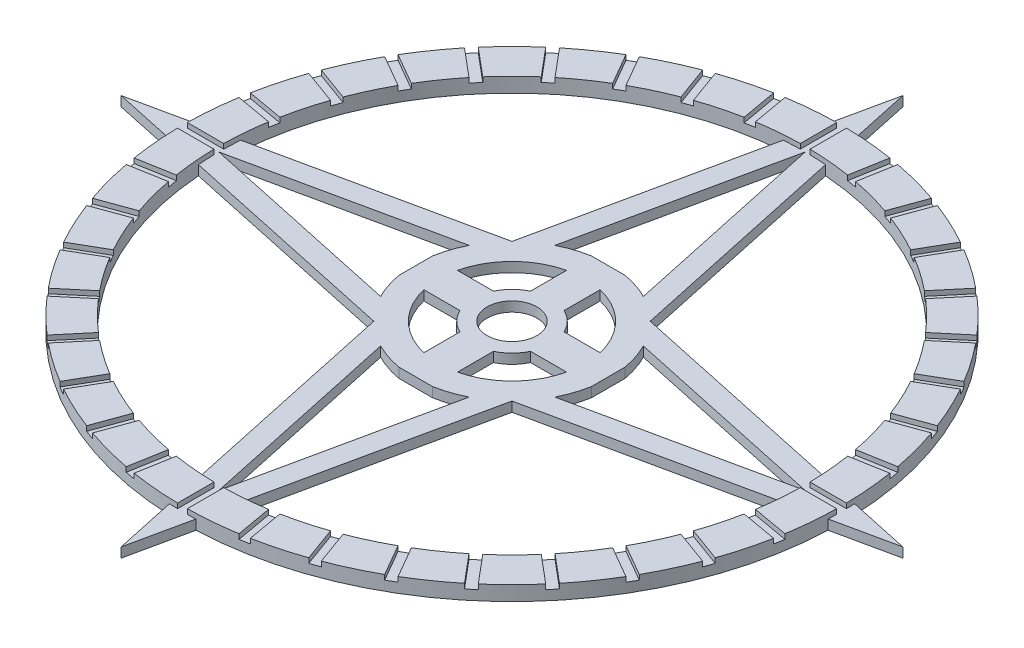
from build123d import *

# Parameters (mm, degrees)
SKETCH1_R           = 5.100000000000002
BOSS_EXTRUDE1_DEPTH = 2
BOSS_EXTRUDE3_START = -2
SKETCH3_R           = 67.45411173885752
SKETCH3_R_2         = 60
BOSS_EXTRUDE3_DEPTH = 3
CUT_EXTRUDE2_START  = -1
CUT_EXTRUDE2_DEPTH  = 1


with BuildPart() as part:
    # Sketch1 → Boss-Extrude1 (new body)
    with BuildSketch(Plane(origin=(0, 0, 0), x_dir=(1, 0, 0), z_dir=(0, 1, 0))):
        Polygon((-14.142135623731019, -14.14213562373088), (-5.5517e-13, -80), (14.142135623730827, -14.142135623731079), (80, -2.7811e-13), (14.142135623731022, 14.142135623730876), (0, 80), (-14.142135623730923, 14.14213562373098), (-80, 8.3796e-13), align=None)
        with BuildLine():
            ThreePointArc((3.435661309281439, -19.702696043128377), (6.31485660112035, -18.97689611362424), (9.054863753710231, -17.83281924996002))
            Line((9.054863753710144, -17.83281924995995), (-4.1567e-13, -60))
            Line((-4.1551e-13, -60), (-9.054863753710384, -17.83281924995984))
            ThreePointArc((-9.054863753710475, -17.832819249959897), (-6.314856601120475, -18.976896113624196), (-3.4356613092814463, -19.702696043128373))
            Line((-3.435661309281439, -19.702696043128373), (3.435661309281439, -19.702696043128373))
        make_face(mode=Mode.SUBTRACT)
        with BuildLine():
            ThreePointArc((-7.224695936017446, -3.4356613092813726), (-5.656854249492367, -5.656854249492393), (-3.4356613092813397, -7.224695936017461))
            Line((-3.435661309281439, -7.224695936017493), (-3.435661309281439, -14.601240747549916))
            ThreePointArc((-3.435661309281024, -14.601240747549827), (-10.606601717798231, -10.606601717798197), (-14.60124074754984, -3.435661309280978))
            Line((-14.601240747549925, -3.4356613092814103), (-7.224695936017458, -3.4356613092814734))
        make_face(mode=Mode.SUBTRACT)
        with BuildLine():
            Line((3.435661309281439, -14.601240747549916), (3.435661309281439, -7.224695936017337))
            ThreePointArc((3.435661309281536, -7.224695936017369), (5.656854249492502, -5.65685424949226), (7.224695936017516, -3.435661309281227))
            Line((7.224695936017593, -3.435661309281478), (14.601240747549618, -3.435661309281494))
            ThreePointArc((14.601240747549667, -3.435661309281709), (10.606601717797965, -10.606601717798464), (3.4356613092810186, -14.601240747549829))
        make_face(mode=Mode.SUBTRACT)
        with Locations(Location((0, 1.78e-15, 0), (0, 0, 270))):
            Circle(SKETCH1_R, mode=Mode.SUBTRACT)
        with BuildLine():
            Line((19.702696043128363, -3.4356613092815045), (19.702696043128384, 3.435661309281374))
            ThreePointArc((19.702696043128388, 3.4356613092813744), (18.97689611362424, 6.314856601120345), (17.832819249959986, 9.054863753710297))
            Line((17.832819249959915, 9.054863753710205), (60, -2.0783e-13))
            Line((60, -2.0828e-13), (17.832819249959876, -9.054863753710324))
            ThreePointArc((17.83281924995993, -9.054863753710412), (18.976896113624196, -6.314856601120477), (19.702696043128363, -3.4356613092815182))
        make_face(mode=Mode.SUBTRACT)
        with BuildLine():
            Line((-17.83281924995999, -9.054863753710078), (-60, 6.2883e-13))
            Line((-60, 6.2847e-13), (-17.832819249959798, 9.054863753710402))
            ThreePointArc((-17.83281924995986, 9.054863753710546), (-18.976896113624175, 6.3148566011205425), (-19.702696043128363, 3.435661309281515))
            Line((-19.702696043128363, 3.435661309281512), (-19.702696043128384, -3.4356613092813664))
            ThreePointArc((-19.70269604312839, -3.435661309281362), (-18.976896113624267, -6.314856601120268), (-17.832819249960053, -9.054863753710169))
        make_face(mode=Mode.SUBTRACT)
        with BuildLine():
            Line((-7.224695936017445, 3.435661309281468), (-14.601240747549904, 3.435661309281494))
            ThreePointArc((-14.601240747549815, 3.435661309281081), (-10.606601717798197, 10.606601717798235), (-3.435661309281025, 14.601240747549829))
            Line((-3.435661309281439, 14.601240747549912), (-3.435661309281439, 7.224695936017497))
            ThreePointArc((-3.435661309281337, 7.224695936017463), (-5.656854249492351, 5.65685424949241), (-7.224695936017428, 3.435661309281412))
        make_face(mode=Mode.SUBTRACT)
        with BuildLine():
            Line((14.601240747549639, 3.4356613092813912), (7.224695936017596, 3.435661309281417))
            ThreePointArc((7.224695936017528, 3.435661309281202), (5.65685424949251, 5.65685424949225), (3.435661309281535, 7.22469593601737))
            Line((3.435661309281439, 7.224695936017337), (3.435661309281439, 14.601240747549912))
            ThreePointArc((3.4356613092810275, 14.601240747549827), (10.606601717798, 10.606601717798428), (14.601240747549687, 3.435661309281623))
        make_face(mode=Mode.SUBTRACT)
        with BuildLine():
            Line((-9.054863753710237, 17.832819249959883), (0, 60))
            Line((0, 60), (9.054863753710263, 17.832819249959897))
            ThreePointArc((9.054863753710354, 17.83281924995996), (6.314856601120406, 18.97689611362422), (3.4356613092814396, 19.702696043128377))
            Line((3.435661309281439, 19.702696043128373), (-3.435661309281439, 19.702696043128373))
            ThreePointArc((-3.4356613092814374, 19.702696043128377), (-6.314856601120412, 18.976896113624218), (-9.05486375371036, 17.832819249959954))
        make_face(mode=Mode.SUBTRACT)
    extrude(amount=BOSS_EXTRUDE1_DEPTH)

    # Sketch3 → Boss-Extrude3 (add)
    with BuildSketch(Plane(origin=(0, 2, 0), x_dir=(1, 0, 0), z_dir=(0, 1, 0)).offset(BOSS_EXTRUDE3_START)):
        with Locations(Location((0, 0, 0), (0, 0, 87.701128414))):
            Circle(SKETCH3_R)
        with Locations(Location((0, 0, 0), (0, 0, 270))):
            Circle(SKETCH3_R_2, mode=Mode.SUBTRACT)
    extrude(amount=BOSS_EXTRUDE3_DEPTH)

    # Sketch4 → Cut-Extrude2 (cut)
    with BuildSketch(Plane(origin=(0, 3, 0), x_dir=(1, 0, 0), z_dir=(0, 1, 0)).offset(CUT_EXTRUDE2_START)):
        with BuildLine():
            ThreePointArc((-0.9999999999980442, 59.99166608788261), (-0.5000173632203273, 59.997916485795386), (3.67e-15, 60))
            ThreePointArc((3.67e-15, 60), (0.5000173632203346, 59.997916485795386), (0.9999999999980382, 59.99166608788261))
            Line((0.9999999999999998, 59.991666087882635), (0.9999999999999998, 67.44669888495864))
            ThreePointArc((0.999999999999044, 67.44669888495862), (-8.9454e-13, 67.45411173885752), (-1.000000000000848, 67.4466988849586))
            Line((-1.0000000000000002, 67.44669888495858), (-1.0000000000000002, 59.991666087882635))
        make_face()
        with BuildLine():
            ThreePointArc((9.4326357383524, 59.25390605713312), (9.926107885630383, 59.1732404237154), (10.418890660015839, 59.088465180732484))
            ThreePointArc((10.418890660015839, 59.088465180732484), (10.910949837511692, 58.99958621586514), (11.40225124437515, 58.90660970179955))
            Line((11.402251244376025, 58.90660970179941), (12.69680410403548, 66.24838379932018))
            ThreePointArc((12.69680410403481, 66.24838379932028), (11.713283579592677, 66.42933221297893), (10.72718859800881, 66.59568015465437))
            Line((10.727188598011047, 66.59568015465393), (9.43263573835161, 59.25390605713328))
        make_face()
        with BuildLine():
            ThreePointArc((19.578665612936884, 56.715746074761306), (20.050633369229132, 56.550615394465474), (20.521208599540167, 56.38155724715448))
            ThreePointArc((20.521208599540167, 56.38155724715448), (20.99035862219668, 56.208583373997016), (21.45805085450822, 56.03170578811017))
            Line((21.458050854509214, 56.031705788109825), (24.007822240262705, 63.03714509523905))
            ThreePointArc((24.007822240263334, 63.037145095238834), (23.070664964830335, 63.38613104267231), (22.128436998691413, 63.72118538189022))
            Line((22.128436998690905, 63.72118538189042), (19.578665612937378, 56.715746074761114))
        make_face()
        with BuildLine():
            ThreePointArc((29.129807640156454, 52.45430684745994), (29.565930504014553, 52.20972853244673), (30.000000000000068, 51.961524227066285))
            ThreePointArc((30.000000000000068, 51.961524227066285), (30.431985981780567, 51.70971116922537), (30.861858447725478, 51.45430684745987))
            Line((30.861858447725794, 51.45430684745969), (34.589374846263794, 57.910554635773664))
            ThreePointArc((34.589374846264285, 57.910554635773394), (33.727055869429066, 58.41697435556455), (32.85732403869491, 58.91055463577369))
            Line((32.857324038694934, 58.91055463577367), (29.129807640156905, 52.45430684745967))
        make_face()
        with BuildLine():
            ThreePointArc((37.79585520262428, 46.599070049758055), (38.18288180151847, 46.28247548836676), (38.56725658119243, 45.96266658713863))
            ThreePointArc((38.56725658119243, 45.96266658713863), (38.94895284663565, 45.63966555695334), (39.32794408886184, 45.31349483038532))
            Line((39.32794408886212, 45.313494830385096), (44.11994680062932, 51.02438127785484))
            ThreePointArc((44.11994680063125, 51.02438127785328), (43.35866724815002, 51.672847463077545), (42.587857914391485, 52.30995649722794))
            Line((42.58785791439141, 52.30995649722799), (37.79585520262415, 46.599070049758176))
        make_face()
        with BuildLine():
            ThreePointArc((45.313494830385466, 39.32794408886167), (45.639665556953474, 38.948952846635486), (45.962666587138756, 38.567256581192275))
            ThreePointArc((45.962666587138756, 38.567256581192275), (46.282475488366885, 38.18288180151831), (46.59907004975818, 37.79585520262413))
            Line((46.5990700497583, 37.795855202624), (52.30995649722813, 42.58785791439124))
            ThreePointArc((52.30995649722806, 42.58785791439132), (51.67284746307768, 43.35866724814985), (51.024381277853436, 44.11994680063108))
            Line((51.024381277855, 44.11994680062915), (45.31349483038523, 39.327944088861955))
        make_face()
        with BuildLine():
            ThreePointArc((51.45430684745998, 30.86185844772529), (51.709711169225486, 30.43198598178038), (51.96152422706639, 29.999999999999876))
            ThreePointArc((51.96152422706639, 29.999999999999876), (52.20972853244683, 29.56593050401436), (52.454306847460046, 29.12980764015626))
            Line((52.45430684745978, 29.12980764015672), (58.9105546357738, 32.85732403869472))
            ThreePointArc((58.91055463577382, 32.857324038694685), (58.41697435556468, 33.72705586942884), (57.91055463577353, 34.589374846264064))
            Line((57.91055463577379, 34.589374846263595), (51.454306847459804, 30.861858447725613))
        make_face()
        with BuildLine():
            ThreePointArc((56.03170578811024, 21.45805085450804), (56.20858337399708, 20.9903586221965), (56.38155724715456, 20.521208599539975))
            ThreePointArc((56.38155724715456, 20.521208599539975), (56.55061539446554, 20.050633369228947), (56.71574607476137, 19.5786656129367))
            Line((56.715746074761185, 19.5786656129372), (63.72118538189049, 22.128436998690695))
            ThreePointArc((63.7211853818903, 22.128436998691214), (63.38613104267238, 23.07066496483013), (63.03714509523891, 24.007822240263124))
            Line((63.037145095239126, 24.007822240262502), (56.0317057881099, 21.458050854509036))
        make_face()
        with BuildLine():
            ThreePointArc((58.906609701799596, 11.402251244374947), (58.99958621586517, 10.910949837511499), (59.08846518073251, 10.418890660015643))
            ThreePointArc((59.08846518073251, 10.418890660015643), (59.173240423715434, 9.926107885630188), (59.25390605713315, 9.432635738352193))
            Line((59.25390605713331, 9.43263573835141), (66.59568015465398, 10.727188598010823))
            ThreePointArc((66.5956801546544, 10.727188598008567), (66.42933221297898, 11.713283579592437), (66.24838379932031, 12.696804104034586))
            Line((66.24838379932021, 12.696804104035254), (58.90660970179945, 11.402251244375828))
        make_face()
        with BuildLine():
            ThreePointArc((59.991666087882614, 0.9999999999978303), (59.997916485795386, 0.5000173632202288), (60, 0))
            ThreePointArc((60, -1.47e-14), (59.997916485795386, -0.5000173632204522), (59.99166608788261, -0.9999999999982624))
            Line((59.991666087882635, -1.0000000000002163), (67.44669888495862, -1.0000000000002423))
            ThreePointArc((67.44669888495861, -0.9999999999994907), (67.45225849992478, -0.5000137374117688), (67.45411173885752, -1.652e-14))
            ThreePointArc((67.45411173885752, 0), (67.45225849992478, 0.5000137374115408), (67.44669888495862, 0.9999999999990511))
            Line((67.44669888495862, 0.9999999999997579), (59.99166608788264, 0.9999999999997838))
        make_face()
        with BuildLine():
            ThreePointArc((59.253906057133094, -9.432635738352582), (59.17324042371537, -9.926107885630579), (59.08846518073245, -10.418890660016032))
            ThreePointArc((59.08846518073245, -10.418890660016032), (58.9995862158651, -10.910949837511886), (58.906609701799525, -11.402251244375329))
            Line((58.906609701799376, -11.402251244376222), (66.24838379932012, -12.6968041040357))
            ThreePointArc((66.24838379932022, -12.696804104035056), (66.42933221297889, -11.713283579592867), (66.59568015465433, -10.727188598009015))
            Line((66.5956801546539, -10.72718859801127), (59.25390605713324, -9.432635738351811))
        make_face()
        with BuildLine():
            ThreePointArc((56.71574607476124, -19.578665612937083), (56.550615394465396, -20.050633369229356), (56.38155724715441, -20.521208599540365))
            ThreePointArc((56.38155724715441, -20.521208599540365), (56.20858337399693, -20.990358622196904), (56.0317057881101, -21.458050854508414))
            Line((56.031705788109754, -21.458050854509413), (63.03714509523896, -24.00782224026293))
            ThreePointArc((63.03714509523877, -24.00782224026351), (63.38613104267225, -23.0706649648305), (63.72118538189016, -22.128436998691623))
            Line((63.721185381890336, -22.128436998691125), (56.71574607476105, -19.57866561293758))
        make_face()
        with BuildLine():
            ThreePointArc((52.45430684745984, -29.12980764015664), (52.209728532446626, -29.565930504014723), (51.96152422706617, -30.00000000000026))
            ThreePointArc((51.96152422706617, -30.00000000000026), (51.70971116922529, -30.431985981780713), (51.45430684745981, -30.861858447725577))
            Line((51.45430684745959, -30.861858447725968), (57.91055463577354, -34.589374846264))
            ThreePointArc((57.910554635773266, -34.5893748462645), (58.41697435556444, -33.72705586942926), (58.91055463577359, -32.85732403869509))
            Line((58.910554635773565, -32.85732403869513), (52.45430684745958, -29.12980764015708))
        make_face()
        with BuildLine():
            ThreePointArc((46.59907004975792, -37.795855202624466), (46.28247548836661, -38.182881801518654), (45.9626665871385, -38.567256581192574))
            ThreePointArc((45.9626665871385, -38.567256581192574), (45.63966555695321, -38.94895284663579), (45.313494830385196, -39.327944088861976))
            Line((45.313494830384975, -39.32794408886225), (51.02438127785471, -44.11994680062948))
            ThreePointArc((51.0243812778531, -44.119946800631446), (51.67284746307738, -43.35866724815021), (52.30995649722778, -42.58785791439167))
            Line((52.30995649722785, -42.587857914391584), (46.599070049758055, -37.7958552026243))
        make_face()
        with BuildLine():
            ThreePointArc((39.327944088861514, -45.3134948303856), (38.94895284663533, -45.63966555695361), (38.56725658119211, -45.96266658713889))
            ThreePointArc((38.56725658119211, -45.96266658713889), (38.18288180151814, -46.28247548836703), (37.795855202623954, -46.59907004975833))
            Line((37.79585520262385, -46.599070049758424), (42.58785791439108, -52.30995649722827))
            ThreePointArc((42.58785791439114, -52.309956497228214), (43.358667248149644, -51.67284746307786), (44.119946800630885, -51.0243812778536))
            Line((44.11994680062899, -51.02438127785514), (39.32794408886181, -45.31349483038535))
        make_face()
        with BuildLine():
            ThreePointArc((30.86185844772505, -51.454306847460124), (30.43198598178014, -51.70971116922562), (29.99999999999968, -51.961524227066505))
            ThreePointArc((29.99999999999968, -51.961524227066505), (29.56593050401419, -52.20972853244693), (29.129807640156102, -52.45430684746013))
            Line((29.12980764015654, -52.45430684745987), (32.85732403869453, -58.91055463577392))
            ThreePointArc((32.85732403869449, -58.910554635773934), (33.72705586942861, -58.41697435556481), (34.589374846263865, -57.91055463577365))
            Line((34.589374846263404, -57.910554635773906), (30.86185844772544, -51.45430684745991))
        make_face()
        with BuildLine():
            ThreePointArc((21.458050854507796, -56.03170578811033), (20.990358622196283, -56.20858337399716), (20.52120859953979, -56.381557247154625))
            ThreePointArc((20.52120859953979, -56.381557247154625), (20.05063336922873, -56.550615394465616), (19.578665612936454, -56.71574607476146))
            Line((19.578665612937, -56.71574607476125), (22.128436998690468, -63.72118538189057))
            ThreePointArc((22.128436998690972, -63.72118538189038), (23.070664964829852, -63.38613104267248), (24.007822240262815, -63.037145095239026))
            Line((24.007822240262282, -63.03714509523922), (21.45805085450884, -56.031705788109974))
        make_face()
        with BuildLine():
            ThreePointArc((11.402251244374728, -58.90660970179964), (10.910949837511284, -58.999586215865214), (10.41889066001543, -59.088465180732555))
            ThreePointArc((10.41889066001543, -59.088465180732555), (9.926107885629975, -59.17324042371547), (9.43263573835203, -59.25390605713318))
            Line((9.43263573835122, -59.25390605713334), (10.72718859801061, -66.59568015465402))
            ThreePointArc((10.727188598008336, -66.59568015465445), (11.713283579592249, -66.429332212979), (12.69680410403438, -66.24838379932035))
            Line((12.69680410403504, -66.24838379932025), (11.402251244375638, -58.906609701799496))
        make_face()
        with BuildLine():
            ThreePointArc((0.9999999999975441, -59.991666087882614), (0.5000173632198937, -59.99791648579539), (-4.3735e-13, -60))
            ThreePointArc((-4.3735e-13, -60), (-0.5000173632207684, -59.997916485795386), (-0.9999999999984186, -59.9916660878826))
            Line((-1.0000000000004188, -59.991666087882635), (-1.0000000000004707, -67.44669888495858))
            ThreePointArc((-1.0000000000013436, -67.44669888495858), (-1.33044e-12, -67.45411173885752), (0.9999999999986232, -67.44669888495862))
            Line((0.9999999999995293, -67.44669888495864), (0.9999999999995813, -59.99166608788264))
        make_face()
        with BuildLine():
            ThreePointArc((-9.432635738352788, -59.25390605713306), (-9.926107885630785, -59.173240423715335), (-10.41889066001624, -59.088465180732406))
            ThreePointArc((-10.41889066001624, -59.088465180732406), (-10.910949837512092, -58.99958621586506), (-11.402251244375536, -58.90660970179948))
            Line((-11.402251244376433, -58.90660970179934), (-12.696804104035934, -66.24838379932008))
            ThreePointArc((-12.696804104035287, -66.24838379932018), (-11.713283579593098, -66.42933221297886), (-10.727188598009247, -66.5956801546543))
            Line((-10.727188598011505, -66.59568015465388), (-9.432635738352017, -59.2539060571332))
        make_face()
        with BuildLine():
            ThreePointArc((-19.57866561293728, -56.71574607476117), (-20.050633369229555, -56.55061539446532), (-20.52120859954056, -56.38155724715435))
            ThreePointArc((-20.52120859954056, -56.38155724715435), (-20.990358622197103, -56.20858337399685), (-21.458050854508613, -56.03170578811002))
            Line((-21.45805085450959, -56.03170578810968), (-24.007822240263124, -63.037145095238884))
            ThreePointArc((-24.00782224026373, -63.03714509523868), (-23.070664964830723, -63.38613104267217), (-22.128436998691846, -63.72118538189007))
            Line((-22.128436998691335, -63.72118538189028), (-19.578665612937765, -56.71574607476099))
        make_face()
        with BuildLine():
            ThreePointArc((-29.129807640156823, -52.45430684745973), (-29.565930504014904, -52.209728532446526), (-30.00000000000044, -51.961524227066064))
            ThreePointArc((-30.00000000000044, -51.961524227066064), (-30.431985981780894, -51.70971116922517), (-30.861858447725755, -51.454306847459705))
            Line((-30.861858447726156, -51.454306847459485), (-34.58937484626421, -57.91055463577342))
            ThreePointArc((-34.589374846264704, -57.910554635773146), (-33.72705586942951, -58.41697435556429), (-32.8573240386954, -58.91055463577342))
            Line((-32.857324038695346, -58.91055463577345), (-29.129807640157264, -52.45430684745946))
        make_face()
        with BuildLine():
            ThreePointArc((-37.79585520262459, -46.59907004975782), (-38.182881801518775, -46.28247548836651), (-38.567256581192744, -45.96266658713836))
            ThreePointArc((-38.567256581192744, -45.96266658713836), (-38.948952846635954, -45.63966555695308), (-39.32794408886214, -45.31349483038506))
            Line((-39.32794408886241, -45.31349483038484), (-44.11994680062966, -51.024381277854566))
            ThreePointArc((-44.1199468006316, -51.02438127785297), (-43.35866724815039, -51.67284746307722), (-42.587857914391904, -52.30995649722759))
            Line((-42.58785791439177, -52.3099564972277), (-37.795855202624466, -46.59907004975793))
        make_face()
        with BuildLine():
            ThreePointArc((-45.313494830385736, -39.32794408886136), (-45.639665556953744, -38.948952846635166), (-45.962666587139005, -38.56725658119197))
            ThreePointArc((-45.962666587139005, -38.56725658119197), (-46.282475488367126, -38.18288180151802), (-46.59907004975843, -37.79585520262383))
            Line((-46.59907004975855, -37.795855202623684), (-52.30995649722842, -42.58785791439089))
            ThreePointArc((-52.30995649722836, -42.58785791439096), (-51.67284746307797, -43.35866724814951), (-51.024381277853735, -44.11994680063073))
            Line((-51.02438127785529, -44.11994680062881), (-45.313494830385494, -39.32794408886166))
        make_face()
        with BuildLine():
            ThreePointArc((-51.45430684746019, -30.861858447724938), (-51.709711169225706, -30.431985981780002), (-51.96152422706661, -29.9999999999995))
            ThreePointArc((-51.96152422706661, -29.9999999999995), (-52.209728532447045, -29.565930504013984), (-52.45430684746026, -29.12980764015587))
            Line((-52.454306847459975, -29.129807640156347), (-58.91055463577403, -32.857324038694316))
            ThreePointArc((-58.91055463577404, -32.85732403869429), (-58.41697435556492, -33.72705586942843), (-57.91055463577377, -34.58937484626366))
            Line((-57.91055463577402, -34.5893748462632), (-51.45430684746002, -30.861858447725254))
        make_face()
        with BuildLine():
            ThreePointArc((-56.03170578811039, -21.45805085450765), (-56.208583373997214, -20.990358622196137), (-56.38155724715469, -20.52120859953962))
            ThreePointArc((-56.38155724715469, -20.52120859953962), (-56.550615394465666, -20.05063336922858), (-56.715746074761505, -19.578665612936305))
            Line((-56.71574607476131, -19.578665612936835), (-63.721185381890635, -22.128436998690287))
            ThreePointArc((-63.72118538189046, -22.128436998690752), (-63.38613104267254, -23.07066496482969), (-63.037145095239076, -24.00782224026271))
            Line((-63.03714509523928, -24.007822240262094), (-56.03170578811003, -21.458050854508674))
        make_face()
        with BuildLine():
            ThreePointArc((-58.90660970179967, -11.40225124437455), (-58.99958621586525, -10.910949837511104), (-59.088465180732584, -10.41889066001525))
            ThreePointArc((-59.088465180732584, -10.41889066001525), (-59.1732404237155, -9.926107885629769), (-59.25390605713322, -9.43263573835177))
            Line((-59.253906057133364, -9.43263573835102), (-66.59568015465405, -10.727188598010382))
            ThreePointArc((-66.59568015465449, -10.727188598008134), (-66.42933221297905, -11.713283579592016), (-66.24838379932041, -12.69680410403415))
            Line((-66.2483837993203, -12.696804104034817), (-58.90660970179953, -11.402251244375442))
        make_face()
        with BuildLine():
            ThreePointArc((-59.99166608788262, -0.9999999999974412), (-59.99791648579539, -0.5000173632200305), (-60, 7.35e-15))
            ThreePointArc((-60, 7.35e-15), (-59.997916485795386, 0.500017363220658), (-59.9916660878826, 0.9999999999986815))
            Line((-59.99166608788263, 1.0000000000006213), (-67.4466988849586, 1.0000000000006994))
            ThreePointArc((-67.4466988849586, 1.0000000000008602), (-67.45411173885752, 6.6728e-13), (-67.44669888495861, -0.999999999999496))
            Line((-67.44669888495861, -0.9999999999993007), (-59.99166608788265, -0.9999999999993787))
        make_face()
        with BuildLine():
            ThreePointArc((-59.25390605713302, 9.432635738352996), (-59.1732404237153, 9.92610788563099), (-59.08846518073238, 10.418890660016446))
            ThreePointArc((-59.08846518073238, 10.418890660016446), (-58.99958621586503, 10.910949837512298), (-58.90660970179944, 11.40225124437574))
            Line((-58.9066097017993, 11.402251244376624), (-66.24838379932004, 12.696804104036147))
            ThreePointArc((-66.24838379932014, 12.69680410403549), (-66.42933221297882, 11.71328357959333), (-66.59568015465426, 10.72718859800948))
            Line((-66.59568015465383, 10.727188598011722), (-59.25390605713317, 9.432635738352209))
        make_face()
        with BuildLine():
            ThreePointArc((-56.71574607476111, 19.578665612937478), (-56.55061539446526, 20.050633369229725), (-56.38155724715427, 20.52120859954076))
            ThreePointArc((-56.38155724715427, 20.52120859954076), (-56.2085833739968, 20.99035862219725), (-56.03170578810996, 21.458050854508784))
            Line((-56.031705788109605, 21.458050854509786), (-63.037145095238806, 24.00782224026335))
            ThreePointArc((-63.037145095238586, 24.00782224026398), (-63.386131042672076, 23.07066496483097), (-63.72118538189001, 22.128436998692038))
            Line((-63.721185381890194, 22.128436998691555), (-56.715746074760915, 19.578665612937964))
        make_face()
        with BuildLine():
            ThreePointArc((-52.45430684745965, 29.129807640156983), (-52.20972853244642, 29.56593050401509), (-51.96152422706598, 30.0000000000006))
            ThreePointArc((-51.96152422706598, 30.0000000000006), (-51.70971116922506, 30.431985981781093), (-51.454306847459556, 30.861858447726004))
            Line((-51.45430684745937, 30.861858447726316), (-57.91055463577331, 34.5893748462644))
            ThreePointArc((-57.91055463577306, 34.58937484626485), (-58.41697435556421, 33.72705586942967), (-58.91055463577333, 32.85732403869555))
            Line((-58.91055463577334, 32.85732403869554), (-52.454306847459364, 29.12980764015744))
        make_face()
        with BuildLine():
            ThreePointArc((-46.59907004975765, 37.79585520262479), (-46.28247548836635, 38.18288180151895), (-45.96266658713823, 38.5672565811929))
            ThreePointArc((-45.96266658713823, 38.5672565811929), (-45.63966555695294, 38.94895284663611), (-45.313494830384926, 39.327944088862296))
            Line((-45.313494830384705, 39.327944088862566), (-51.02438127785441, 44.11994680062983))
            ThreePointArc((-51.02438127785283, 44.119946800631766), (-51.67284746307711, 43.358667248150525), (-52.3099564972275, 42.58785791439201))
            Line((-52.30995649722757, 42.58785791439194), (-46.5990700497578, 37.795855202624615))
        make_face()
        with BuildLine():
            ThreePointArc((-39.3279440888612, 45.31349483038588), (-38.94895284663501, 45.63966555695389), (-38.567256581191806, 45.96266658713915))
            ThreePointArc((-38.567256581191806, 45.96266658713915), (-38.18288180151784, 46.282475488367275), (-37.79585520262364, 46.59907004975858))
            Line((-37.79585520262353, 46.59907004975869), (-42.58785791439071, 52.30995649722857))
            ThreePointArc((-42.587857914390796, 52.30995649722849), (-43.35866724814933, 51.67284746307812), (-44.11994680063055, 51.024381277853884))
            Line((-44.119946800628625, 51.02438127785545), (-39.32794408886151, 45.31349483038563))
        make_face()
        with BuildLine():
            ThreePointArc((-30.861858447724757, 51.4543068474603), (-30.431985981779846, 51.7097111692258), (-29.99999999999934, 51.9615242270667))
            ThreePointArc((-29.99999999999934, 51.9615242270667), (-29.565930504013824, 52.20972853244714), (-29.129807640155736, 52.45430684746034))
            Line((-29.129807640156177, 52.45430684746008), (-32.85732403869412, 58.91055463577414))
            ThreePointArc((-32.8573240386941, 58.91055463577414), (-33.727055869428256, 58.41697435556502), (-34.58937484626346, 57.91055463577389))
            Line((-34.589374846262984, 57.91055463577415), (-30.861858447725076, 51.454306847460124))
        make_face()
        with BuildLine():
            ThreePointArc((-21.45805085450748, 56.03170578811046), (-20.990358622195938, 56.208583373997286), (-20.52120859953941, 56.38155724715477))
            ThreePointArc((-20.52120859953941, 56.38155724715477), (-20.050633369228372, 56.55061539446574), (-19.57866561293612, 56.715746074761576))
            Line((-19.578665612936632, 56.71574607476138), (-22.128436998690063, 63.72118538189072))
            ThreePointArc((-22.12843699869057, 63.72118538189052), (-23.070664964829497, 63.386131042672616), (-24.007822240262485, 63.037145095239154))
            Line((-24.00782224026187, 63.03714509523937), (-21.458050854508475, 56.03170578811011))
        make_face()
        with BuildLine():
            ThreePointArc((-11.402251244374343, 58.90660970179971), (-10.910949837510898, 58.999586215865286), (-10.418890660015045, 59.08846518073262))
            ThreePointArc((-10.418890660015045, 59.08846518073262), (-9.926107885629587, 59.173240423715534), (-9.432635738351603, 59.25390605713325))
            Line((-9.432635738350806, 59.253906057133406), (-10.727188598010141, 66.59568015465409))
            ThreePointArc((-10.727188598007885, 66.59568015465452), (-11.713283579591753, 66.42933221297909), (-12.696804104033903, 66.24838379932045))
            Line((-12.696804104034578, 66.24838379932035), (-11.402251244375227, 58.90660970179957))
        make_face()
    extrude(amount=CUT_EXTRUDE2_DEPTH, mode=Mode.SUBTRACT)


solid = part.part
